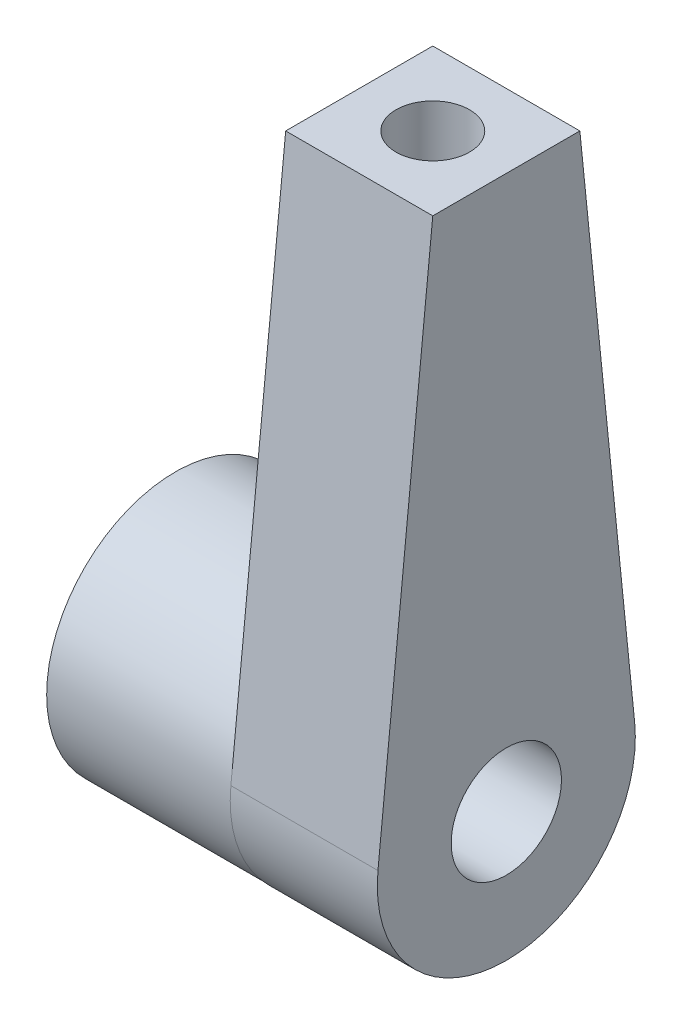
from build123d import *

# Parameters (mm, degrees)
SKETCH1_R           = 3
BOSS_EXTRUDE1_DEPTH = 8
SKETCH2_R           = 7
SKETCH2_R_2         = 3
BOSS_EXTRUDE2_DEPTH = 10
SKETCH3_R           = 2
CUT_EXTRUDE1_DEPTH  = 22


with BuildPart() as part:
    # Sketch1 → Boss-Extrude1 (new body)
    with BuildSketch(Plane(origin=(0, 0, 0), x_dir=(0, 0, -1), z_dir=(1, 0, 0))):
        with BuildLine():
            Line((-4, 0), (-6.981160767, -29.34898091))
            ThreePointArc((-6.981160767, -29.34898091), (0, -37.075184621), (6.981160767, -29.34898091))
            Line((6.981160767, -29.34898091), (4, 0))
            Line((4, 0), (-4, 0))
        make_face()
        with Locations((0, -30.058101362)):
            Circle(SKETCH1_R, mode=Mode.SUBTRACT)
    extrude(amount=-BOSS_EXTRUDE1_DEPTH)

    # Sketch2 → Boss-Extrude2 (add)
    with BuildSketch(Plane.ZY.offset(8)):
        with Locations((0, -30.058101362)):
            Circle(SKETCH2_R)
        with Locations(Location((0, -30.058101362, 0), (0, 0, 180))):
            Circle(SKETCH2_R_2, mode=Mode.SUBTRACT)
    extrude(amount=BOSS_EXTRUDE2_DEPTH)

    # Sketch3 → Cut-Extrude1 (cut)
    with BuildSketch(Plane(origin=(0, 0, 0), x_dir=(1, 0, 0), z_dir=(0, 1, 0))):
        with Locations(Location((-4, 0, 0), (0, 0, 270))):
            Circle(SKETCH3_R)
    extrude(amount=-CUT_EXTRUDE1_DEPTH, mode=Mode.SUBTRACT)


solid = part.part
